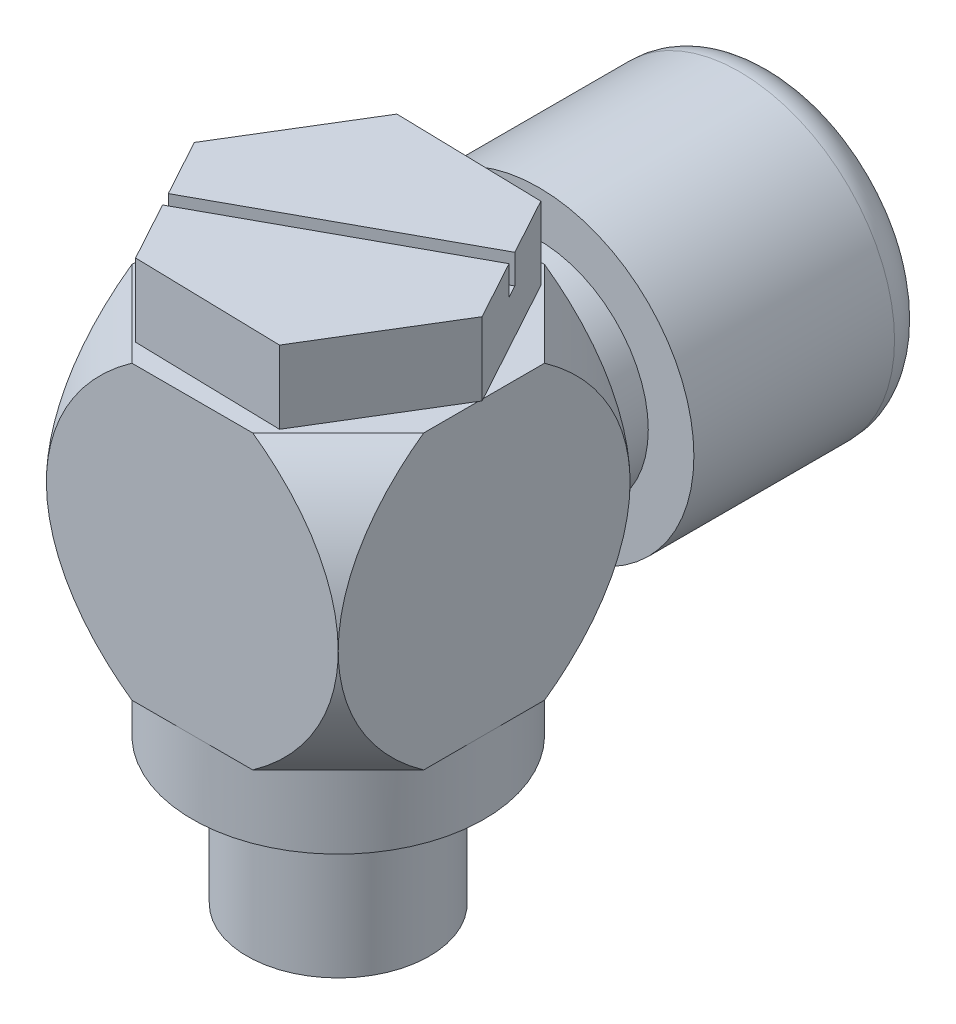
from build123d import *

# Parameters (mm, degrees)
ESQUISSE1_W             = 8
ESQUISSE1_H             = 8
EXTRUSION1_DEPTH        = 8
ESQUISSE2_R             = 7.864437578
ESQUISSE2_R_2           = 5.656854249
ENL_V_MAT_EXTRU_1_DEPTH = 9
ESQUISSE3_R             = 8.352248068
ESQUISSE3_R_2           = 5.656854249
ENL_V_MAT_EXTRU_2_DEPTH = 9
EXTRUSION2_DEPTH        = 2
ESQUISSE5_R             = 4
EXTRUSION3_DEPTH        = 2
ESQUISSE6_R             = 2.5
EXTRUSION4_DEPTH        = 4
ESQUISSE7_R             = 3
EXTRUSION5_DEPTH        = 1.5
ESQUISSE8_R             = 4.25
EXTRUSION6_DEPTH        = 6.5
CONG_1_R                = 1
ENL_V_MAT_EXTRU_3_DEPTH = 0.8


with BuildPart() as part:
    # Esquisse1 → Extrusion1 (new body)
    with BuildSketch(Plane.XY):
        with Locations((-4.627553444, -9.439073634)):
            Rectangle(ESQUISSE1_W, ESQUISSE1_H)
    extrude(amount=EXTRUSION1_DEPTH)

    # Esquisse2 → Enlèv. mat.-Extru.1 (cut, symmetric)
    with BuildSketch(Plane(origin=(-4.313776722, 0, 4.313776722), x_dir=(-0.7071067811865488, 0, -0.7071067811865462), z_dir=(0.7071067811865462, 0, -0.7071067811865488))):
        with Locations((0.443747296, -9.439073634)):
            Circle(ESQUISSE2_R)
        with Locations((0.443747296, -9.439073634)):
            Circle(ESQUISSE2_R_2, mode=Mode.SUBTRACT)
    extrude(amount=ENL_V_MAT_EXTRU_1_DEPTH, both=True, mode=Mode.SUBTRACT)

    # Esquisse3 → Enlèv. mat.-Extru.2 (cut, symmetric)
    with BuildSketch(Plane(origin=(-0.313776722, 0, -0.313776722), x_dir=(0.7071067811865483, 0, -0.7071067811865468), z_dir=(0.7071067811865468, 0, 0.7071067811865483))):
        with Locations((-6.100601545, -9.439073634)):
            Circle(ESQUISSE3_R)
        with Locations((-6.100601545, -9.439073634)):
            Circle(ESQUISSE3_R_2, mode=Mode.SUBTRACT)
    extrude(amount=ENL_V_MAT_EXTRU_2_DEPTH, both=True, mode=Mode.SUBTRACT)

    # Esquisse4 → Extrusion2 (add)
    with BuildSketch(Plane(origin=(0, -5.439073634, 0), x_dir=(-1, 0, 0), z_dir=(0, 1, 0))):
        Polygon((2.690239828, 7.546850615), (0.5872339, 4.095662501), (2.524547516, 0.548811886), (6.564867061, 0.453149385), (8.667872988, 3.904337499), (6.730559372, 7.451188114), align=None)
    extrude(amount=EXTRUSION2_DEPTH)

    # Esquisse5 → Extrusion3 (add)
    with BuildSketch(Plane.XZ.offset(13.439073634)):
        with Locations(Location((-4.627553444, 4, 0), (0, 0, 270))):
            Circle(ESQUISSE5_R)
    extrude(amount=EXTRUSION3_DEPTH)

    # Esquisse6 → Extrusion4 (add)
    with BuildSketch(Plane.XZ.offset(15.439073634)):
        with Locations(Location((-4.627553444, 4, 0), (0, 0, 270))):
            Circle(ESQUISSE6_R)
    extrude(amount=EXTRUSION4_DEPTH)

    # Esquisse7 → Extrusion5 (add)
    with BuildSketch(Plane(origin=(0, 0, 0), x_dir=(-1, 0, 0), z_dir=(0, 0, -1))):
        with Locations(Location((4.627553444, -9.439073634, 0), (0, 0, 180))):
            Circle(ESQUISSE7_R)
    extrude(amount=EXTRUSION5_DEPTH)

    # Esquisse8 → Extrusion6 (add)
    with BuildSketch(Plane(origin=(0, 0, -1.5), x_dir=(-1, 0, 0), z_dir=(0, 0, -1))):
        with Locations(Location((4.627553444, -9.439073634, 0), (0, 0, 180))):
            Circle(ESQUISSE8_R)
    extrude(amount=EXTRUSION6_DEPTH)

    # Congé1
    cong_1_edges = [part.edges().sort_by_distance(p)[0] for p in [
        (-8.877553444, -9.439073634, -8),
    ]]
    fillet(cong_1_edges, radius=CONG_1_R)

    # Esquisse9 → Enlèv. mat.-Extru.3 (cut)
    with BuildSketch(Plane(origin=(0, -3.439073634, 0), x_dir=(-1, 0, 0), z_dir=(0, 1, 0))):
        Polygon((1.321943124, 1.93003998), (8.151603046, 5.660446078), (7.960645286, 6.010053204), (1.130985365, 2.279647106), align=None)
    extrude(amount=-ENL_V_MAT_EXTRU_3_DEPTH, mode=Mode.SUBTRACT)


solid = part.part
